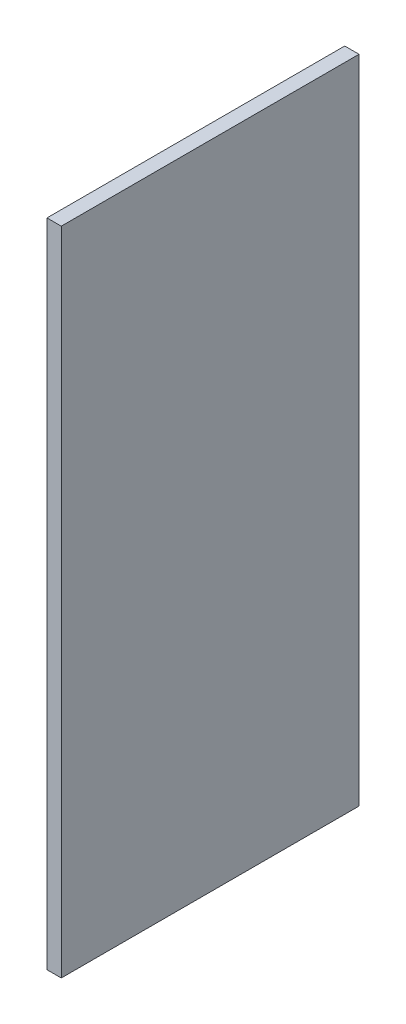
from build123d import *

# Parameters (mm, degrees)
SKPAREDGRANDEESTE_W   = 18
SKPAREDGRANDEESTE_H   = 375
PAREDGRANDEESTE_DEPTH = 820


with BuildPart() as part:
    # SkParedGrandeEste → ParedGrandeEste (new body)
    with BuildSketch(Plane(origin=(0, 50, 0), x_dir=(1, 0, 0), z_dir=(0, 1, 0))):
        with Locations((194, 0)):
            Rectangle(SKPAREDGRANDEESTE_W, SKPAREDGRANDEESTE_H)
    extrude(amount=PAREDGRANDEESTE_DEPTH)


solid = part.part
